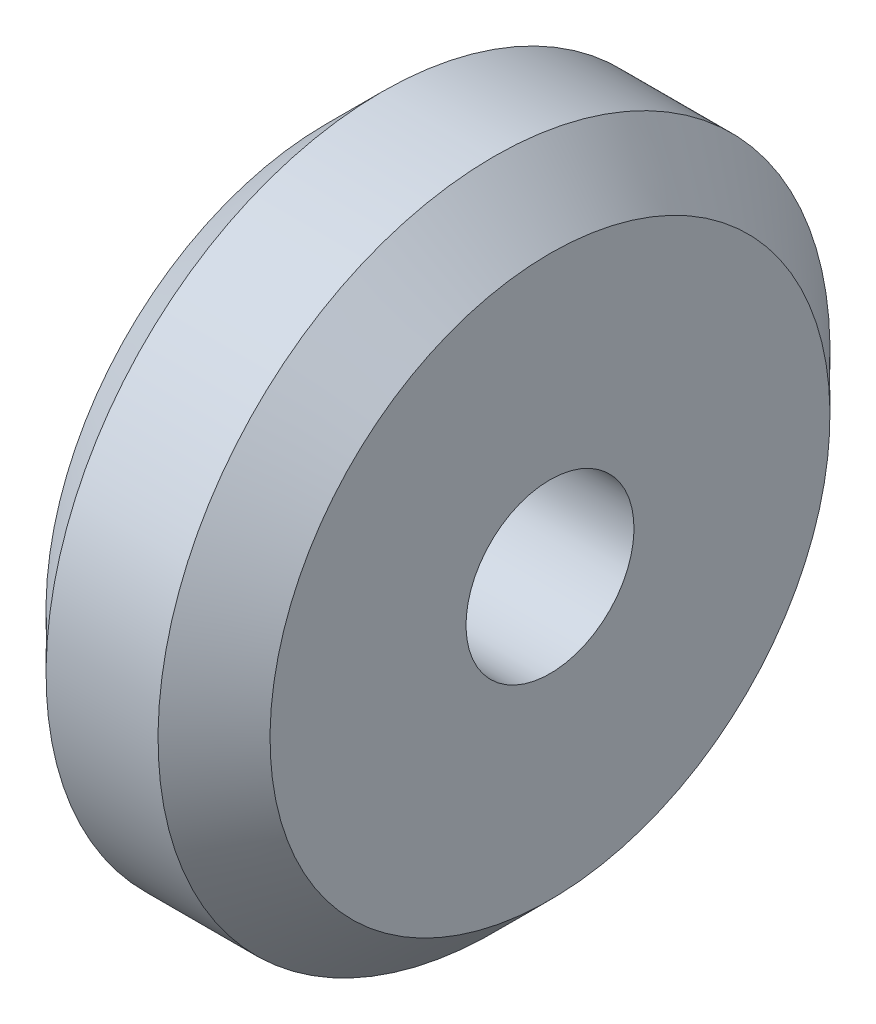
from build123d import *

# Parameters (mm, degrees)
SKETCH2_R          = 3
CUT_EXTRUDE1_DEPTH = 10


with BuildPart() as part:
    # Sketch1 → Revolve1 (revolve)
    with BuildSketch(Plane.XY):
        Polygon((0, 0), (0, 10), (2, 12), (6, 12), (8, 10), (8, 0), align=None)
    revolve(axis=Axis((8, 0, 0), (-1, 0, 0)))

    # Sketch2 → Cut-Extrude1 (cut)
    with BuildSketch(Plane(origin=(8, 0, 0), x_dir=(0, 0, -1), z_dir=(1, 0, 0))):
        with Locations(Location((0, 0, 0), (0, 0, 90))):
            Circle(SKETCH2_R)
    extrude(amount=-CUT_EXTRUDE1_DEPTH, mode=Mode.SUBTRACT)


solid = part.part
